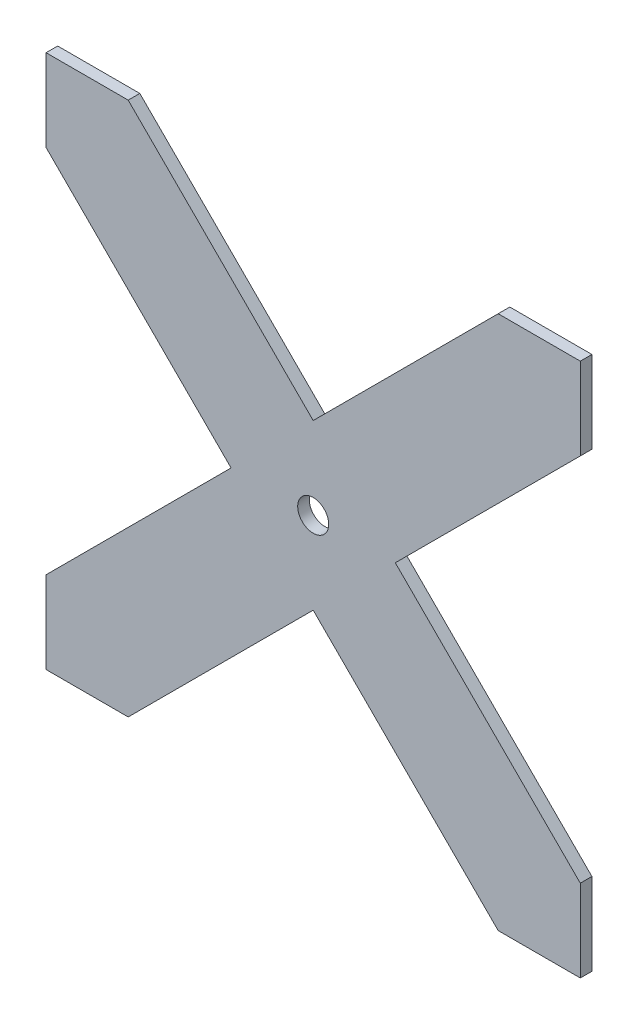
from build123d import *

# Parameters (mm, degrees)
BOSS_EXTRUDE1_DEPTH     = 3
BOSS_EXTRUDE2_DEPTH     = 3
CUT_EXTRUDE1_DEPTH      = 164.987660837
CUT_EXTRUDE1_DEPTH_BACK = 164.987660837
SKETCH9_R               = 4


with BuildPart() as part:
    # Sketch7 → Boss-Extrude1 (new body)
    with BuildSketch(Plane.XY):
        Polygon((-78.549032868, 130.117059275), (38.237763696, 13.33026271), (38.237763696, -7.882940725), (17.02456026, -7.882940725), (-99.762236304, 108.903855839), (-99.762236304, 130.117059275), align=None)
    extrude(amount=BOSS_EXTRUDE1_DEPTH)

    # Sketch8 → Boss-Extrude2 (add)
    with BuildSketch(Plane.XY):
        Polygon((-78.549032868, -7.882940725), (38.237763696, 108.903855839), (38.237763696, 130.117059275), (17.02456026, 130.117059275), (-99.762236304, 13.33026271), (-99.762236304, -7.882940725), align=None)
    extrude(amount=BOSS_EXTRUDE2_DEPTH)

    # Sketch9 → Cut-Extrude1 (cut, two sides: drawn at the far end of the back side and taken through both)
    with BuildSketch(Plane.XY.offset(3).offset(-CUT_EXTRUDE1_DEPTH_BACK)):
        with Locations((-30.762236304, 61.117059275)):
            Circle(SKETCH9_R)
    extrude(amount=CUT_EXTRUDE1_DEPTH + CUT_EXTRUDE1_DEPTH_BACK, mode=Mode.SUBTRACT)


solid = part.part
